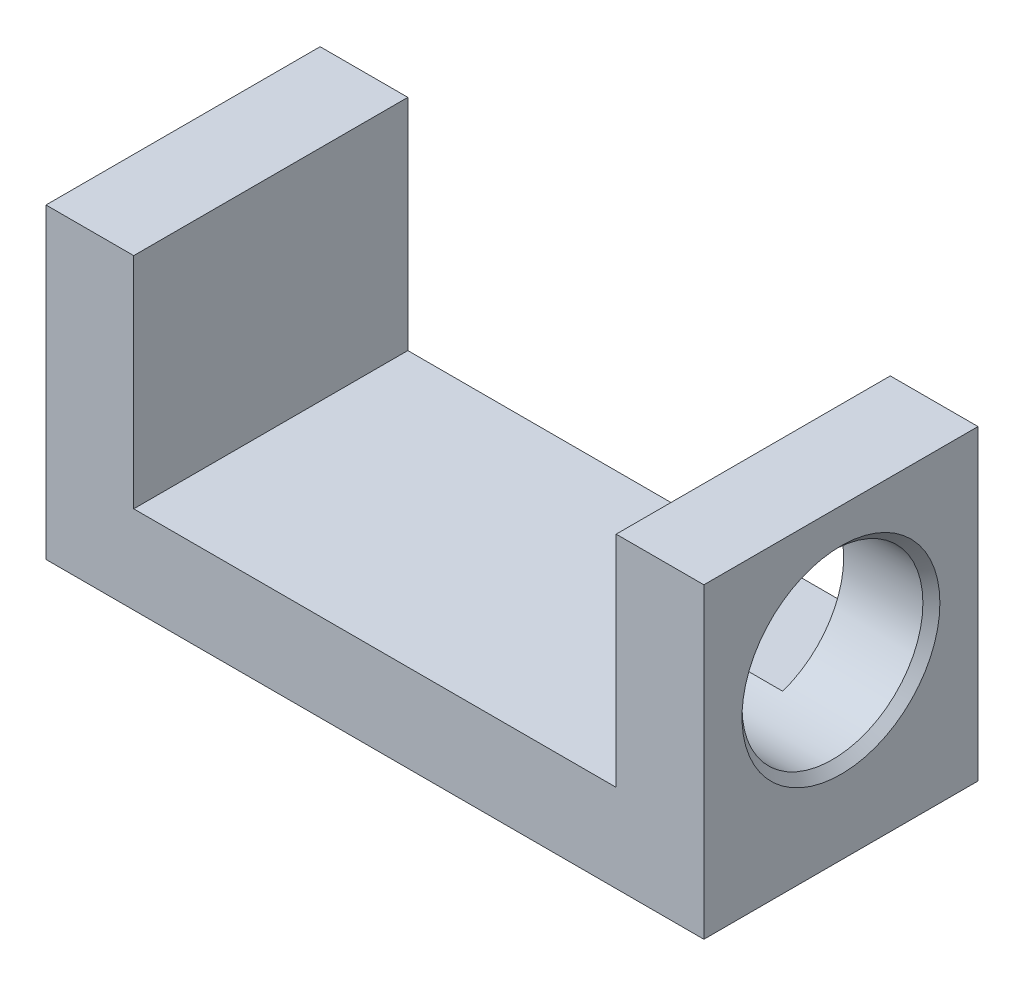
from build123d import *

# Parameters (mm, degrees)
SKETCH_1_W               = 60
SKETCH_1_H               = 28
EXTRUDE_1_DEPTH          = 12.5
CUT_EXTRUDE_1_DEPTH      = 64.292100613
CUT_EXTRUDE_1_DEPTH_BACK = 64.292100613
SKETCH_2_W               = 44
SKETCH_2_H               = 20
M18X1_51_D               = 16.5
M18X1_51_DEPTH           = 13
M18X1_51_CSINK_D         = 18.05
M18X1_51_CSINK_ANGLE     = 90
M18X1_51_TIP             = 4.957100107


with BuildPart() as part:
    # Эскиз1 → Бобышка-Вытянуть1 (new, symmetric)
    with BuildSketch(Plane.XY):
        with Locations((-30, -1.8)):
            Rectangle(SKETCH_1_W, SKETCH_1_H)
    extrude(amount=EXTRUDE_1_DEPTH, both=True)

    # Эскиз2 → Вырез-Вытянуть1 (cut, two sides: drawn at the far end of the back side and taken through both)
    with BuildSketch(Plane.XY.offset(-CUT_EXTRUDE_1_DEPTH_BACK)):
        with Locations((-30, 2.2)):
            Rectangle(SKETCH_2_W, SKETCH_2_H)
    extrude(amount=CUT_EXTRUDE_1_DEPTH + CUT_EXTRUDE_1_DEPTH_BACK, mode=Mode.SUBTRACT)

    # Отверстие обработанное метчиком M18x1.51
    with Locations(Plane(origin=(0, 0, 0), x_dir=(0, 0, -1), z_dir=(1, 0, 0))):
        with Locations((0, 0)):
            CounterSinkHole(M18X1_51_D / 2, M18X1_51_CSINK_D / 2, depth=M18X1_51_DEPTH, counter_sink_angle=M18X1_51_CSINK_ANGLE)
            with Locations((0, 0, -(M18X1_51_DEPTH + M18X1_51_TIP / 2))):  # 118° drill point
                Cone(0, M18X1_51_D / 2, M18X1_51_TIP, mode=Mode.SUBTRACT)


solid = part.part
